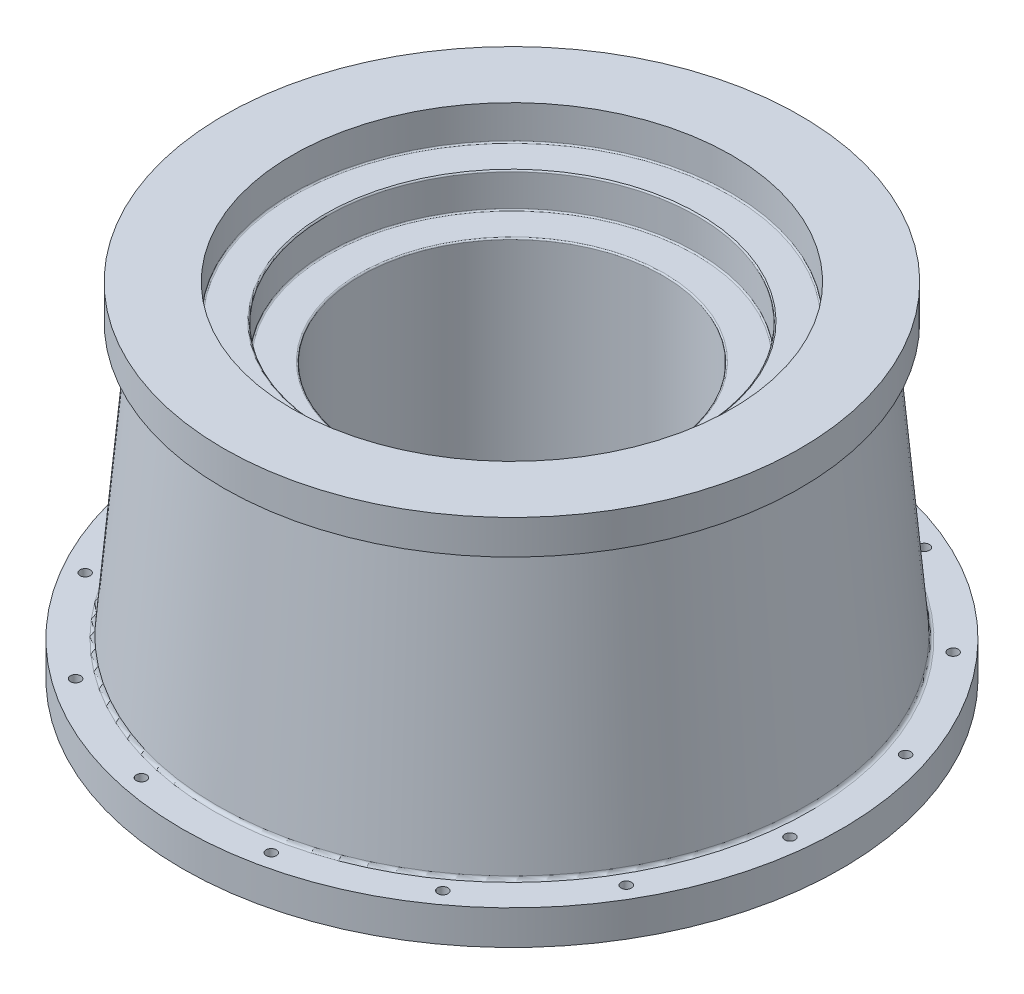
from build123d import *

# Parameters (mm, degrees)
SKETCH3_R          = 7.5
CUT_EXTRUDE1_DEPTH = 815.426972557
CIRPATTERN1_COUNT  = 15
FILLET1_R          = 2
FILLET2_R          = 5


with BuildPart() as part:
    # Sketch2 → Revolve1 (revolve)
    with BuildSketch(Plane.XY, mode=Mode.PRIVATE) as revolve1_sk:
        Polygon((-220, 0), (-479.99546541, 0), (-479.99546541, 50), (-429.99546541, 50), (-395, 450), (-420, 450), (-420, 500), (-320, 500), (-320, 450), (-270, 450), (-270, 400), (-220, 400), align=None)
    revolve(revolve1_sk.sketch.rotate(Axis((0, 634.313776754, 0), (0, -1, 0)), 270), axis=Axis((0, 634.313776754, 0), (0, -1, 0)))

    # Sketch3 → Cut-Extrude1 (cut, through all)
    with BuildSketch(Plane(origin=(0, 50, 0), x_dir=(1, 0, 0), z_dir=(0, 1, 0))):
        with Locations(Location((0, 454.99546541, 0), (0, 0, 270))):
            Circle(SKETCH3_R)
    cut_extrude1 = extrude(amount=-CUT_EXTRUDE1_DEPTH, mode=Mode.SUBTRACT)

    # CirPattern1: Cut-Extrude1 ×15 about axis
    cirpattern1_axis = Axis((0, 0, 0), (0, 1, 0))
    for i in range(1, CIRPATTERN1_COUNT):
        add(cut_extrude1.rotate(cirpattern1_axis, i * 360 / CIRPATTERN1_COUNT), mode=Mode.SUBTRACT)

    # Fillet1
    fillet1_edges = [part.edges().sort_by_distance(p)[0] for p in [
        (0, 450, -270),
        (0, 450, -320),
        (0, 400, -220),
        (0, 400, -270),
    ]]
    fillet(fillet1_edges, radius=FILLET1_R)

    # Fillet2
    fillet2_edges = [part.edges().sort_by_distance(p)[0] for p in [
        (0, 450, -395),
        (0, 50, -429.99546541),
    ]]
    fillet(fillet2_edges, radius=FILLET2_R)


solid = part.part
